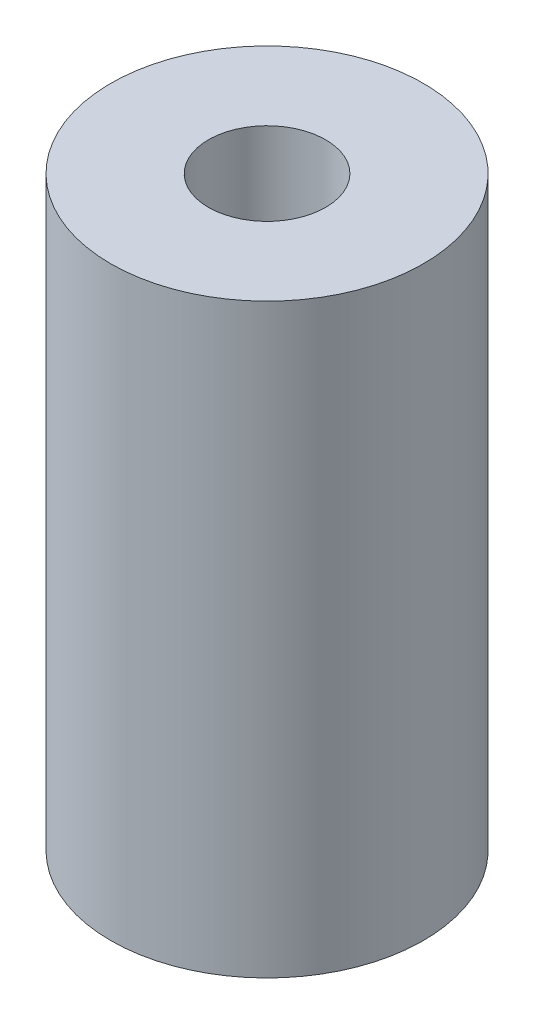
from build123d import *

# Parameters (mm, degrees)
SKETCH1_R           = 4
BOSS_EXTRUDE1_DEPTH = 15
SKETCH2_R           = 1.5
CUT_EXTRUDE1_DEPTH  = 17.031219542


with BuildPart() as part:
    # Sketch1 → Boss-Extrude1 (new body)
    with BuildSketch(Plane(origin=(0, 0, 0), x_dir=(1, 0, 0), z_dir=(0, 1, 0))):
        with Locations(Location((0, 0, 0), (0, 0, 270))):
            Circle(SKETCH1_R)
    extrude(amount=BOSS_EXTRUDE1_DEPTH)

    # Sketch2 → Cut-Extrude1 (cut, through all)
    with BuildSketch(Plane(origin=(0, 15, 0), x_dir=(1, 0, 0), z_dir=(0, 1, 0))):
        with Locations(Location((0, 0, 0), (0, 0, 270))):
            Circle(SKETCH2_R)
    extrude(amount=-CUT_EXTRUDE1_DEPTH, mode=Mode.SUBTRACT)


solid = part.part
